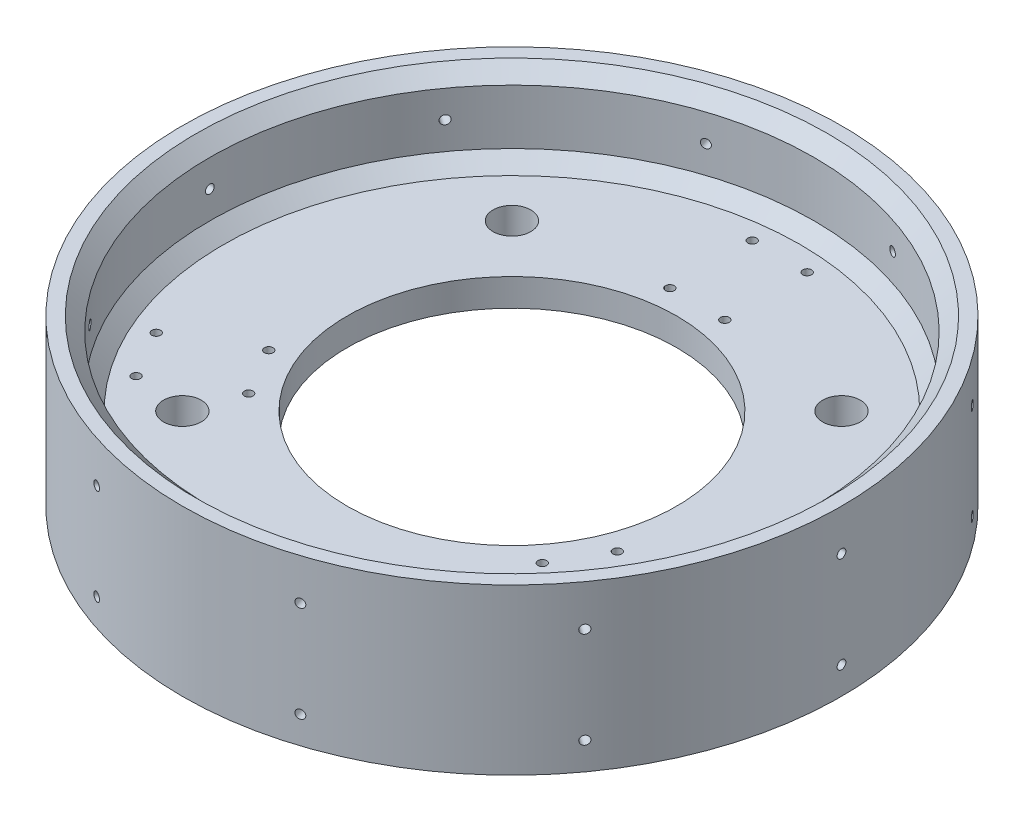
from build123d import *

# Parameters (mm, degrees)
CHAMFER1_SIZE                   = 6.35
F_10_32_TAPPED_HOLE1_AT_2_COUNT = 2
F_10_32_TAPPED_HOLE1_AT_2_PITCH = 44.45
CIRPATTERN1_COUNT               = 10
F_3_4_16_TAPPED_HOLE1_D         = 17.4625
F_10_32_TAPPED_HOLE2_D          = 4.0386


with BuildPart() as part:
    # Sketch1 → Revolve1 (revolve)
    with BuildSketch(Plane.XY, mode=Mode.PRIVATE) as revolve1_sk:
        Polygon((76.2, 0), (139.7, 0), (139.7, -25.4), (152.4, -25.4), (152.4, 50.8), (139.7, 50.8), (139.7, 12.7), (76.2, 12.7), align=None)
    revolve(revolve1_sk.sketch.rotate(Axis((0, 156.31682243, 0), (0, -1, 0)), 90), axis=Axis((0, 156.31682243, 0), (0, -1, 0)))

    # Chamfer1
    chamfer1_edges = [part.edges().sort_by_distance(p)[0] for p in [
        (0, 12.7, -139.7),
        (0, 50.8, -139.7),
        (0, -25.4, -139.7),
        (0, 0, -139.7),
    ]]
    chamfer(chamfer1_edges, length=CHAMFER1_SIZE)

    # Sketch3 → #10-32 Tapped Hole1 (revolve, cut)
    with BuildSketch(Plane(origin=(152.4, 31.75, 0), x_dir=(0, 0, -1), z_dir=(0, 1, 0))):
        Polygon((0, 0), (0, 14.929317848), (2.0193, 13.716), (2.0193, 0), align=None)
    f_10_32_tapped_hole1 = revolve(axis=Axis((158.75, 31.75, 0), (-1, 0, 0)), mode=Mode.SUBTRACT)

    # #10-32 Tapped Hole1 at 2: #10-32 Tapped Hole1 ×2
    with Locations(*[(0, -i * F_10_32_TAPPED_HOLE1_AT_2_PITCH, 0) for i in range(1, F_10_32_TAPPED_HOLE1_AT_2_COUNT)]):
        add(f_10_32_tapped_hole1, mode=Mode.SUBTRACT)

    # CirPattern1: #10-32 Tapped Hole1 ×10 about axis
    cirpattern1_axis = Axis((0, 156.31682243, 0), (0, 1, 0))
    for i in range(1, CIRPATTERN1_COUNT):
        add(f_10_32_tapped_hole1.rotate(cirpattern1_axis, i * 360 / CIRPATTERN1_COUNT), mode=Mode.SUBTRACT)

    # CirPattern1 copy 1 sketch → CirPattern1 copy 1 (revolve, cut)
    with BuildSketch(Plane(origin=(123.294189943, -12.7, -89.578472449), x_dir=(-0.5877852522924731, 0, -0.8090169943749475), z_dir=(0, 1, 0))):
        Polygon((0, 0), (0, 14.929317848), (2.0193, 13.716), (2.0193, 0), align=None)
    revolve(axis=Axis((128.431447857, -12.7, -93.310908801), (-0.8090169943749475, 0, 0.5877852522924731)), mode=Mode.SUBTRACT)

    # CirPattern1 copy 2 sketch → CirPattern1 copy 2 (revolve, cut)
    with BuildSketch(Plane(origin=(47.094189943, -12.7, -144.941013083), x_dir=(-0.9510565162951535, 0, -0.3090169943749475), z_dir=(0, 1, 0))):
        Polygon((0, 0), (0, 14.929317848), (2.0193, 13.716), (2.0193, 0), align=None)
    revolve(axis=Axis((49.056447857, -12.7, -150.980221962), (-0.3090169943749475, 0, 0.9510565162951535)), mode=Mode.SUBTRACT)

    # CirPattern1 copy 3 sketch → CirPattern1 copy 3 (revolve, cut)
    with BuildSketch(Plane(origin=(-47.094189943, -12.7, -144.941013083), x_dir=(-0.9510565162951536, 0, 0.3090169943749473), z_dir=(0, 1, 0))):
        Polygon((0, 0), (0, 14.929317848), (2.0193, 13.716), (2.0193, 0), align=None)
    revolve(axis=Axis((-49.056447857, -12.7, -150.980221962), (0.3090169943749473, 0, 0.9510565162951536)), mode=Mode.SUBTRACT)

    # CirPattern1 copy 4 sketch → CirPattern1 copy 4 (revolve, cut)
    with BuildSketch(Plane(origin=(-123.294189943, -12.7, -89.578472449), x_dir=(-0.5877852522924732, 0, 0.8090169943749473), z_dir=(0, 1, 0))):
        Polygon((0, 0), (0, 14.929317848), (2.0193, 13.716), (2.0193, 0), align=None)
    revolve(axis=Axis((-128.431447857, -12.7, -93.310908801), (0.8090169943749473, 0, 0.5877852522924732)), mode=Mode.SUBTRACT)

    # CirPattern1 copy 5 sketch → CirPattern1 copy 5 (revolve, cut)
    with BuildSketch(Plane(origin=(-152.4, -12.7, 0), x_dir=(0, 0, 1), z_dir=(0, 1, 0))):
        Polygon((0, 0), (0, 14.929317848), (2.0193, 13.716), (2.0193, 0), align=None)
    revolve(axis=Axis((-158.75, -12.7, 0), (1, 0, 0)), mode=Mode.SUBTRACT)

    # CirPattern1 copy 6 sketch → CirPattern1 copy 6 (revolve, cut)
    with BuildSketch(Plane(origin=(-123.294189943, -12.7, 89.578472449), x_dir=(0.587785252292473, 0, 0.8090169943749476), z_dir=(0, 1, 0))):
        Polygon((0, 0), (0, 14.929317848), (2.0193, 13.716), (2.0193, 0), align=None)
    revolve(axis=Axis((-128.431447857, -12.7, 93.310908801), (0.8090169943749476, 0, -0.587785252292473)), mode=Mode.SUBTRACT)

    # CirPattern1 copy 7 sketch → CirPattern1 copy 7 (revolve, cut)
    with BuildSketch(Plane(origin=(-47.094189943, -12.7, 144.941013083), x_dir=(0.9510565162951535, 0, 0.3090169943749476), z_dir=(0, 1, 0))):
        Polygon((0, 0), (0, 14.929317848), (2.0193, 13.716), (2.0193, 0), align=None)
    revolve(axis=Axis((-49.056447857, -12.7, 150.980221962), (0.3090169943749476, 0, -0.9510565162951535)), mode=Mode.SUBTRACT)

    # CirPattern1 copy 8 sketch → CirPattern1 copy 8 (revolve, cut)
    with BuildSketch(Plane(origin=(47.094189943, -12.7, 144.941013083), x_dir=(0.9510565162951536, 0, -0.3090169943749472), z_dir=(0, 1, 0))):
        Polygon((0, 0), (0, 14.929317848), (2.0193, 13.716), (2.0193, 0), align=None)
    revolve(axis=Axis((49.056447857, -12.7, 150.980221962), (-0.3090169943749472, 0, -0.9510565162951536)), mode=Mode.SUBTRACT)

    # CirPattern1 copy 9 sketch → CirPattern1 copy 9 (revolve, cut)
    with BuildSketch(Plane(origin=(123.294189943, -12.7, 89.578472449), x_dir=(0.5877852522924734, 0, -0.8090169943749473), z_dir=(0, 1, 0))):
        Polygon((0, 0), (0, 14.929317848), (2.0193, 13.716), (2.0193, 0), align=None)
    revolve(axis=Axis((128.431447857, -12.7, 93.310908801), (-0.8090169943749473, 0, -0.5877852522924734)), mode=Mode.SUBTRACT)

    # 3/4-16 Tapped Hole1 (through all)
    with Locations(Plane(origin=(-76.2, 12.7, -76.2), x_dir=(0, 0, 1), z_dir=(0, 1, 0))):
        with Locations((0, 0), (0, 152.4), (152.4, 152.4), (152.4, 0)):
            Hole(F_3_4_16_TAPPED_HOLE1_D / 2)

    # #10-32 Tapped Hole2 (through all)
    with Locations(Plane(origin=(-12.7, 12.7, -85.725), x_dir=(0, 0, 1), z_dir=(0, 1, 0))):
        with Locations((0, 0), (0, 25.4), (-38.1, 25.4), (-38.1, 0), (158.636022628, 113.585595624), (136.638977372, 126.285595624), (139.586022628, 80.590027739), (117.588977372, 93.290027739), (139.586022628, -55.190027739), (117.588977372, -67.890027739), (136.638977372, -100.885595624), (158.636022628, -88.185595624)):
            Hole(F_10_32_TAPPED_HOLE2_D / 2)


solid = part.part
